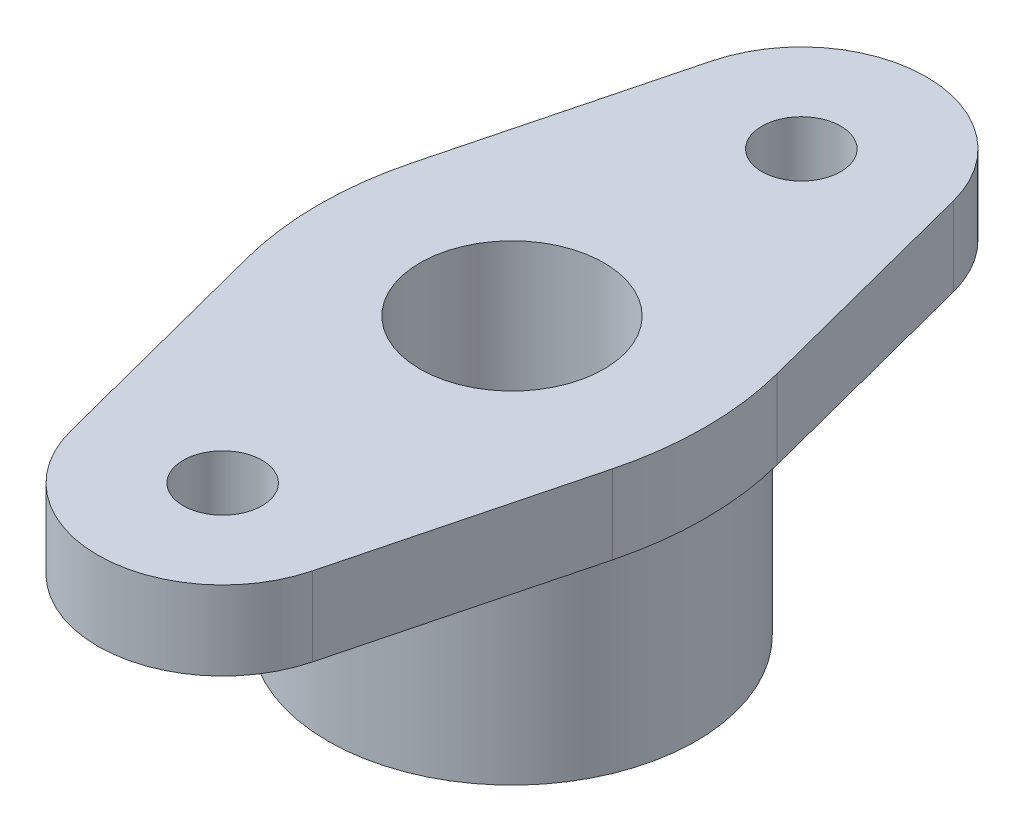
from build123d import *

# Parameters (mm, degrees)
SKETCH7_R           = 14
SKETCH7_R_2         = 6
BOSS_EXTRUDE2_DEPTH = 12
FILLET3_R           = 50


with BuildPart() as part:
    # Sketch7 → Boss-Extrude2 (new body)
    with BuildSketch(Plane(origin=(0, 0, 0), x_dir=(1, 0, 0), z_dir=(0, 1, 0))):
        with BuildLine():
            ThreePointArc((18.395196505, -48.755706629), (0, -63), (-18.395196505, -48.755706629))
            Line((-18.395196505, -48.755706629), (-31, 0))
            Line((-31, 0), (-18.395196505, 48.755706629))
            ThreePointArc((-18.395196505, 48.755706629), (0, 63), (18.395196505, 48.755706629))
            Line((18.395196505, 48.755706629), (31, 0))
            Line((31, 0), (18.395196505, -48.755706629))
        make_face()
        with Locations(Location((0, 0, 0), (0, 0, 270))):
            Circle(SKETCH7_R, mode=Mode.SUBTRACT)
        with Locations(Location((0, 44, 0), (0, 0, 270))):
            Circle(SKETCH7_R_2, mode=Mode.SUBTRACT)
        with Locations(Location((0, -44, 0), (0, 0, 270))):
            Circle(SKETCH7_R_2, mode=Mode.SUBTRACT)
    extrude(amount=BOSS_EXTRUDE2_DEPTH)

    # Fillet3
    fillet3_edges = [part.edges().sort_by_distance(p)[0] for p in [
        (-31, 6, 0),
        (31, 6, 0),
    ]]
    fillet(fillet3_edges, radius=FILLET3_R)

    # Sketch8 → Revolve2 (revolve)
    with BuildSketch(Plane(origin=(0, 0, 0), x_dir=(0, 0, -1), z_dir=(1, 0, 0)), mode=Mode.PRIVATE) as revolve2_sk:
        Polygon((14, 0), (28, 0), (28, -30), (14, -21.917096231), align=None)
    revolve(revolve2_sk.sketch.rotate(Axis((0, 25.452541032, 0), (0, -1, 0)), 180), axis=Axis((0, 25.452541032, 0), (0, -1, 0)))


solid = part.part
